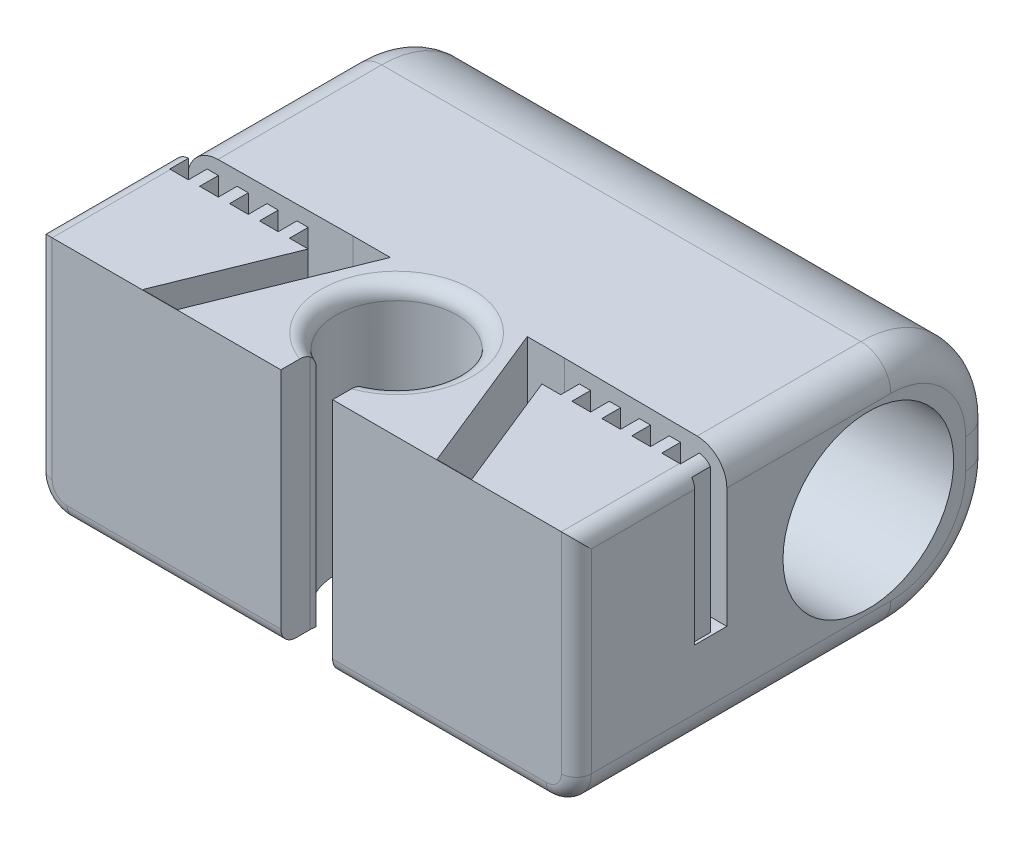
from build123d import *

# Parameters (mm, degrees)
SALIENTE_EXTRUIR1_DEPTH = 16
CROQUIS5_R              = 5.7
CORTAR_EXTRUIR1_DEPTH   = 38
SALIENTE_EXTRUIR2_DEPTH = 0.6
CORTAR_EXTRUIR2_DEPTH   = 10
REDONDEO1_R             = 7
REDONDEO2_R             = 2
REDONDEO3_R             = 1
REDONDEO5_R             = 1
SALIENTE_EXTRUIR3_START = -2
CROQUIS10_R             = 5.7
CROQUIS10_R_2           = 4.7
SALIENTE_EXTRUIR3_DEPTH = 2


with BuildPart() as part:
    # Croquis1 → Saliente-Extruir1 (new body)
    with BuildSketch(Plane(origin=(0, 0, 0), x_dir=(1, 0, 0), z_dir=(0, 1, 0))):
        with BuildLine():
            Line((-16.125, 9.1375), (19.875, 9.1375))
            Line((19.875, 9.1375), (19.875, -18.8625))
            Line((19.875, -18.8625), (3.603278106, -18.8625))
            Line((3.603278106, -18.8625), (3.603278106, -16.9125))
            ThreePointArc((3.603278106, -16.9125), (3.593299591, -16.727049938), (3.563479273, -16.543741332))
            ThreePointArc((3.563479273, -16.543741332), (1.875, -8.8125), (0.186520727, -16.543741332))
            ThreePointArc((0.186520727, -16.543741332), (0.156700409, -16.727049938), (0.146721894, -16.9125))
            Line((0.146721894, -16.9125), (0.146721894, -18.8625))
            Line((0.146721894, -18.8625), (-16.125, -18.8625))
            Line((-16.125, -18.8625), (-16.125, 9.1375))
        make_face()
    extrude(amount=SALIENTE_EXTRUIR1_DEPTH)

    # Croquis5 → Cortar-Extruir1 (cut)
    with BuildSketch(Plane(origin=(19.875, 0, 0), x_dir=(0, 0, -1), z_dir=(1, 0, 0))):
        with Locations((0.6375, 8)):
            Circle(CROQUIS5_R)
    extrude(amount=-CORTAR_EXTRUIR1_DEPTH, mode=Mode.SUBTRACT)

    # Croquis8 → Saliente-Extruir2 (add)
    with BuildSketch(Plane.XZ):
        with BuildLine():
            Line((-2.175, 12.8625), (5.925, 12.8625))
            ThreePointArc((5.925, 12.8625), (1.875, 8.8125), (-2.175, 12.8625))
        make_face()
    extrude(amount=-SALIENTE_EXTRUIR2_DEPTH)

    # Croquis9 → Cortar-Extruir2 (cut)
    with BuildSketch(Plane(origin=(0, 16, 0), x_dir=(1, 0, 0), z_dir=(0, 1, 0))):
        Polygon((-15.929202857, -9.7125), (-15.929202857, -10.9625), (-16.125, -10.9625), (-16.125, -8.8125), (-5.179202857, -8.7125), (-2.700687259, -8.7125), (-6.793467705, -18.842487075), (-9.112924295, -18.842487075), (-5.929202857, -10.9625), (-7.179202857, -10.9625), (-7.179202857, -9.7125), (-7.929202857, -9.7125), (-7.929202857, -10.9625), (-9.179202857, -10.9625), (-9.179202857, -9.7125), (-9.929202857, -9.7125), (-9.929202857, -10.9625), (-11.179202857, -10.9625), (-11.179202857, -9.7125), (-11.929202857, -9.7125), (-11.929202857, -10.9625), (-13.179202857, -10.9625), (-13.179202857, -9.7125), (-13.929202857, -9.7125), (-13.929202857, -10.9625), (-15.179202857, -10.9625), (-15.179202857, -9.7125), align=None)
        Polygon((12.862924295, -18.842487075), (10.543467705, -18.842487075), (6.450687259, -8.7125), (8.929202857, -8.7125), (19.875, -8.8125), (19.875, -10.9625), (19.679202857, -10.9625), (19.679202857, -9.7125), (18.929202857, -9.7125), (18.929202857, -10.9625), (17.679202857, -10.9625), (17.679202857, -9.7125), (16.929202857, -9.7125), (16.929202857, -10.9625), (15.679202857, -10.9625), (15.679202857, -9.7125), (14.929202857, -9.7125), (14.929202857, -10.9625), (13.679202857, -10.9625), (13.679202857, -9.7125), (12.929202857, -9.7125), (12.929202857, -10.9625), (11.679202857, -10.9625), (11.679202857, -9.7125), (10.929202857, -9.7125), (10.929202857, -10.9625), (9.679202857, -10.9625), align=None)
    extrude(amount=-CORTAR_EXTRUIR2_DEPTH, mode=Mode.SUBTRACT)

    # Redondeo1
    redondeo1_edges = [part.edges().sort_by_distance(p)[0] for p in [
        (1.875, 16, -9.1375),
        (1.875, 0, -9.1375),
    ]]
    fillet(redondeo1_edges, radius=REDONDEO1_R)

    # Redondeo2
    redondeo2_edges = [part.edges().sort_by_distance(p)[0] for p in [
        (19.875, 16, 3.3375),
        (-16.125, 16, 3.3375),
        (-16.125, 8, -9.1375),
        (-16.125, 0, 8.3625),
        (-16.125, 2.050252532, -7.087247468),
        (-16.125, 13.949747468, -7.087247468),
        (19.875, 8, -9.1375),
        (19.875, 2.050252532, -7.087247468),
        (19.875, 13.949747468, -7.087247468),
        (19.875, 0, 8.3625),
    ]]
    fillet(redondeo2_edges, radius=REDONDEO2_R)

    # Redondeo3
    redondeo3_edges = [part.edges().sort_by_distance(p)[0] for p in [
        (1.875, 16, 8.8125),
    ]]
    fillet(redondeo3_edges, radius=REDONDEO3_R)

    # Redondeo5
    redondeo5_edges = [part.edges().sort_by_distance(p)[0] for p in [
        (10.739139053, 0, 18.8625),
        (19.289213562, 0.585786438, 18.8625),
        (-6.989139053, 0, 18.8625),
        (-15.539213562, 0.585786438, 18.8625),
        (19.875, 9, 18.8625),
        (-16.125, 9, 18.8625),
        (-16.125, 16, 14.9125),
        (19.875, 16, 14.9125),
    ]]
    fillet(redondeo5_edges, radius=REDONDEO5_R)

    # Croquis10 → Saliente-Extruir3 (add)
    with BuildSketch(Plane.ZY.offset(16.125).offset(SALIENTE_EXTRUIR3_START)):
        with Locations(Location((-0.6375, 8, 0), (0, 0, 180))):
            Circle(CROQUIS10_R)
        with Locations((-0.6375, 8)):
            Circle(CROQUIS10_R_2, mode=Mode.SUBTRACT)
    extrude(amount=SALIENTE_EXTRUIR3_DEPTH)


solid = part.part
